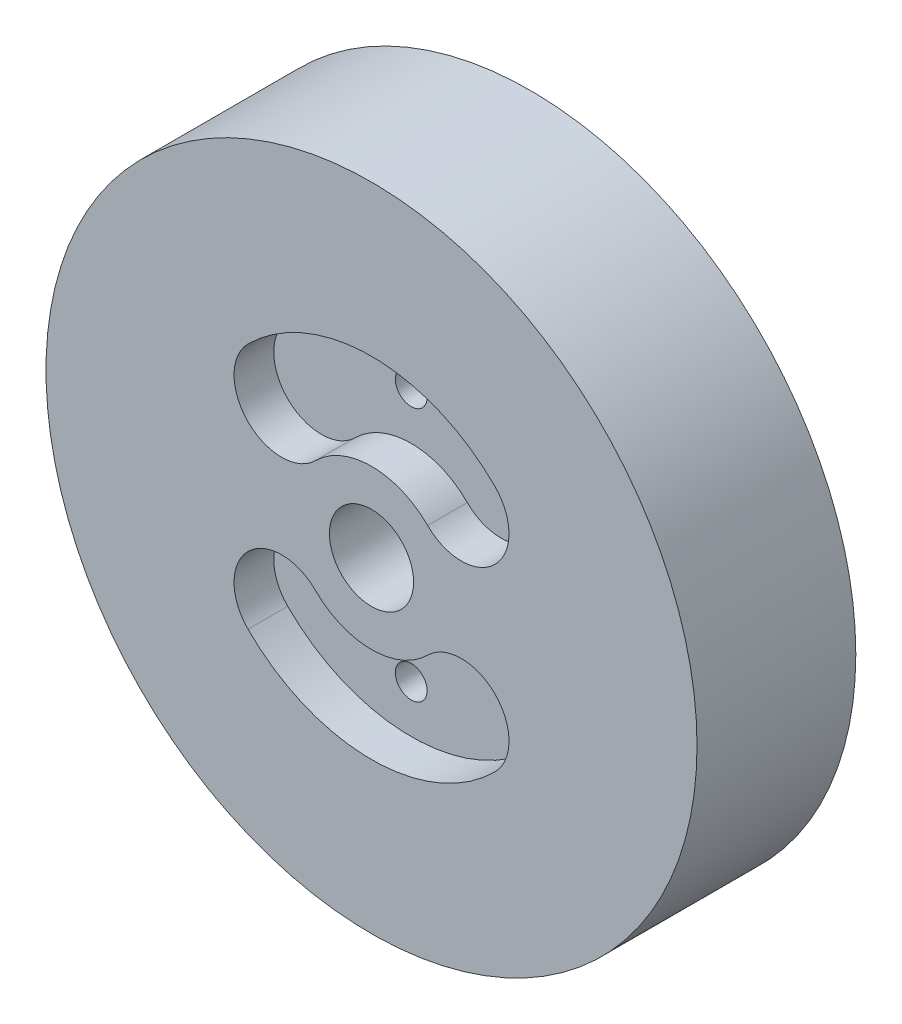
from build123d import *

# Parameters (mm, degrees)
SKETCH_1_R               = 20.5
EXTRUDE_1_DEPTH          = 5
HOLE_WIZARD_M5_1_D       = 5.3
HOLE_WIZARD_M5_2_D       = 5.3
HOLE_WIZARD_M5_2_DEPTH   = 5
CUT_EXTRUDE_1_DEPTH      = 2.5
HOLE_WIZARD_2_0_2_1_D    = 2
PATTERN_CIRCULAR_1_COUNT = 2


with BuildPart() as part:
    # 스케치1 → 보스-돌출1 (new, symmetric)
    with BuildSketch(Plane.XY):
        Circle(SKETCH_1_R)
    extrude(amount=EXTRUDE_1_DEPTH, both=True)

    # M5 여유 구멍1 (through all)
    with Locations(Plane.XY.offset(5)):
        with Locations((0, 0)):
            Hole(HOLE_WIZARD_M5_1_D / 2)

    # M5 여유 구멍2
    with Locations(Plane(origin=(0, 0, -5), x_dir=(-1, 0, 0), z_dir=(0, 0, -1))):
        with Locations((12.5, 0)):
            hole_wizard_m5_2 = Hole(HOLE_WIZARD_M5_2_D / 2, depth=HOLE_WIZARD_M5_2_DEPTH)

    # 대칭 복사1: M5 여유 구멍2 across plane
    add(hole_wizard_m5_2.mirror(Plane(origin=(0, 0, 0), x_dir=(0, 0, 1), z_dir=(1, 0, 0))), mode=Mode.SUBTRACT)

    # 스케치6 → 컷-돌출1 (cut)
    with BuildSketch(Plane.XY.offset(5)):
        with BuildLine():
            ThreePointArc((7.778174593, 7.778174593), (0, 11), (-7.778174593, 7.778174593))
            ThreePointArc((-7.778174593, 7.778174593), (-7.778174593, 3.535533906), (-3.535533906, 3.535533906))
            ThreePointArc((-3.535533906, 3.535533906), (0, 5), (3.535533906, 3.535533906))
            ThreePointArc((3.535533906, 3.535533906), (7.778174593, 3.535533906), (7.778174593, 7.778174593))
        make_face()
    cut_extrude_1 = extrude(amount=-CUT_EXTRUDE_1_DEPTH, mode=Mode.SUBTRACT)

    # Ø2.0 (2) 지름 구멍1 (through all)
    with Locations(Plane.XY.offset(2.5)):
        with Locations((0, 8)):
            hole_wizard_2_0_2_1 = Hole(HOLE_WIZARD_2_0_2_1_D / 2)

    # 원형 패턴1: 컷-돌출1, Ø2.0 (2) 지름 구멍1 ×2 about axis
    pattern_circular_1_axis = Axis((0, 0, 0), (0, 0, 1))
    add([cut_extrude_1.rotate(pattern_circular_1_axis, i * 360 / PATTERN_CIRCULAR_1_COUNT) for i in range(1, PATTERN_CIRCULAR_1_COUNT)], mode=Mode.SUBTRACT)
    add([hole_wizard_2_0_2_1.rotate(pattern_circular_1_axis, i * 360 / PATTERN_CIRCULAR_1_COUNT) for i in range(1, PATTERN_CIRCULAR_1_COUNT)], mode=Mode.SUBTRACT)


solid = part.part
